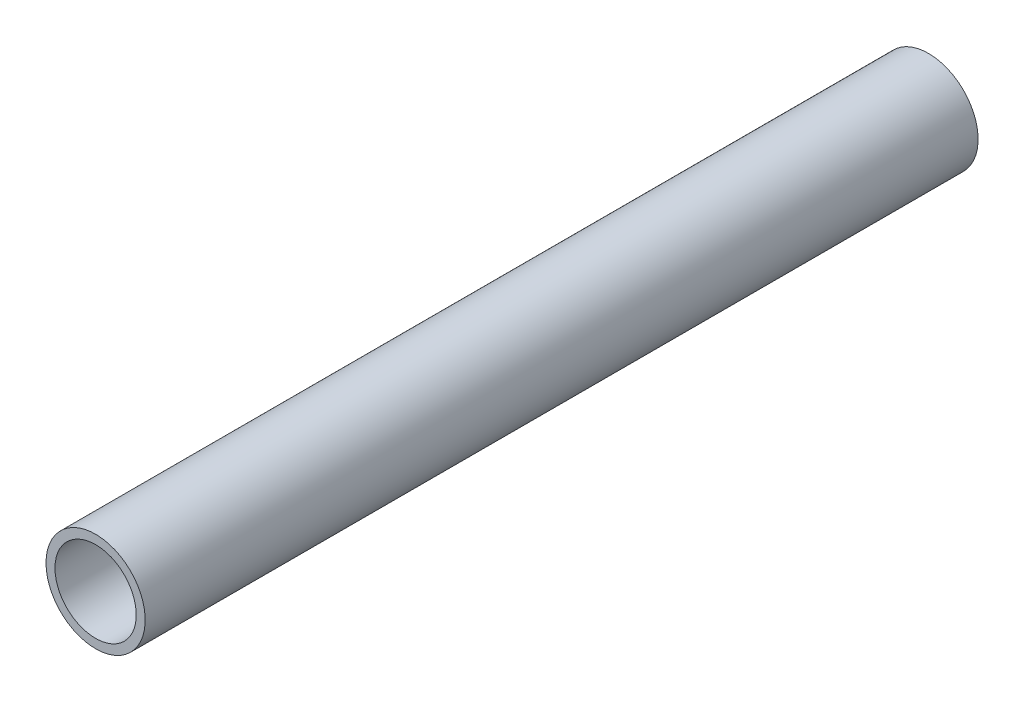
from build123d import *

# Parameters (mm, degrees)
SKETCH2_R           = 21.082
SKETCH2_R_2         = 17.272
BOSS_EXTRUDE1_DEPTH = 354.0125


with BuildPart() as part:
    # Sketch2 → Boss-Extrude1 (new body)
    with BuildSketch(Plane.XY):
        Circle(SKETCH2_R)
        Circle(SKETCH2_R_2, mode=Mode.SUBTRACT)
    extrude(amount=BOSS_EXTRUDE1_DEPTH)


solid = part.part
